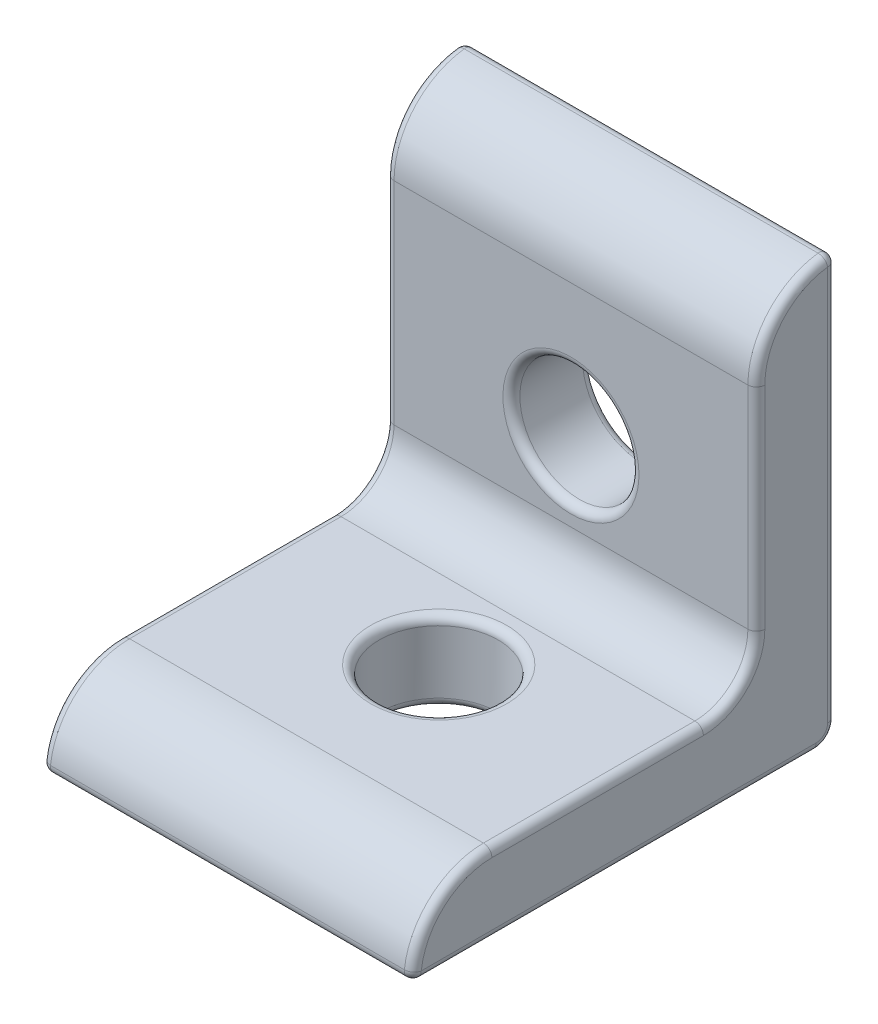
from build123d import *

# Parameters (mm, degrees)
BOSS_EXTRUDE1_START = 11.1125
BOSS_EXTRUDE1_DEPTH = 22.225
FILLET1_R           = 1.1938
SKETCH4_R           = 3.5687
CUT_EXTRUDE1_DEPTH  = 27.648827953
SKETCH5_R           = 3.5687
CUT_EXTRUDE2_DEPTH  = 32.213016617
FILLET2_R           = 0.508
FILLET3_R           = 0.508


with BuildPart() as part:
    # Sketch3 → Boss-Extrude1 (new body)
    with BuildSketch(Plane(origin=(0, 0, 0), x_dir=(0, 0, -1), z_dir=(1, 0, 0)).offset(BOSS_EXTRUDE1_START)):
        with BuildLine():
            Line((-3.175, -7.9248), (-15.8496, -7.9248))
            ThreePointArc((-15.8496, -7.9248), (-19.226176302, -9.323423698), (-20.6248, -12.7))
            Line((-20.6248, -12.7), (4.7752, -12.7))
            Line((4.7752, -12.7), (4.7752, 12.7))
            ThreePointArc((4.7752, 12.7), (1.398623698, 11.301376302), (0, 7.9248))
            Line((0, 7.9248), (0, -4.7498))
            ThreePointArc((0, -4.7498), (-0.92993597, -6.99486403), (-3.175, -7.9248))
        make_face()
    extrude(amount=-BOSS_EXTRUDE1_DEPTH)

    # Fillet1
    fillet1_edges = [part.edges().sort_by_distance(p)[0] for p in [
        (0, -12.7, -4.7752),
    ]]
    fillet(fillet1_edges, radius=FILLET1_R)

    # Sketch4 → Cut-Extrude1 (cut, through all)
    with BuildSketch(Plane.XY):
        Circle(SKETCH4_R)
    extrude(amount=-CUT_EXTRUDE1_DEPTH, mode=Mode.SUBTRACT)

    # Sketch5 → Cut-Extrude2 (cut, through all)
    with BuildSketch(Plane(origin=(0, -7.9248, 0), x_dir=(1, 0, 0), z_dir=(0, 1, 0))):
        with Locations(Location((0, -7.9248, 0), (0, 0, 270))):
            Circle(SKETCH5_R)
    extrude(amount=-CUT_EXTRUDE2_DEPTH, mode=Mode.SUBTRACT)

    # Fillet2
    fillet2_edges = [part.edges().sort_by_distance(p)[0] for p in [
        (0, 12.7, -4.7752),
        (0, -12.7, 20.6248),
        (-11.1125, 11.301376302, -1.398623698),
        (-11.1125, 1.5875, 0),
        (-11.1125, -6.99486403, 0.92993597),
        (-11.1125, -7.9248, 9.5123),
        (11.1125, 0.5969, -4.7752),
        (11.1125, -12.350344075, -4.425544075),
        (-11.1125, 0.5969, -4.7752),
        (-11.1125, -12.350344075, -4.425544075),
        (0, -12.7, 4.3561),
        (-11.1125, -9.323423698, 19.226176302),
        (11.1125, -7.9248, 9.5123),
        (-11.1125, -12.7, 8.5217),
        (11.1125, -6.99486403, 0.92993597),
        (11.1125, 1.5875, 0),
        (11.1125, 11.301376302, -1.398623698),
        (11.1125, -12.7, 8.5217),
        (11.1125, -9.323423698, 19.226176302),
    ]]
    fillet(fillet2_edges, radius=FILLET2_R)

    # Fillet3
    fillet3_edges = [part.edges().sort_by_distance(p)[0] for p in [
        (-3.5687, 0, -4.7752),
        (-3.5687, 0, 0),
        (0, -7.9248, 4.3561),
    ]]
    fillet(fillet3_edges, radius=FILLET3_R)


solid = part.part
